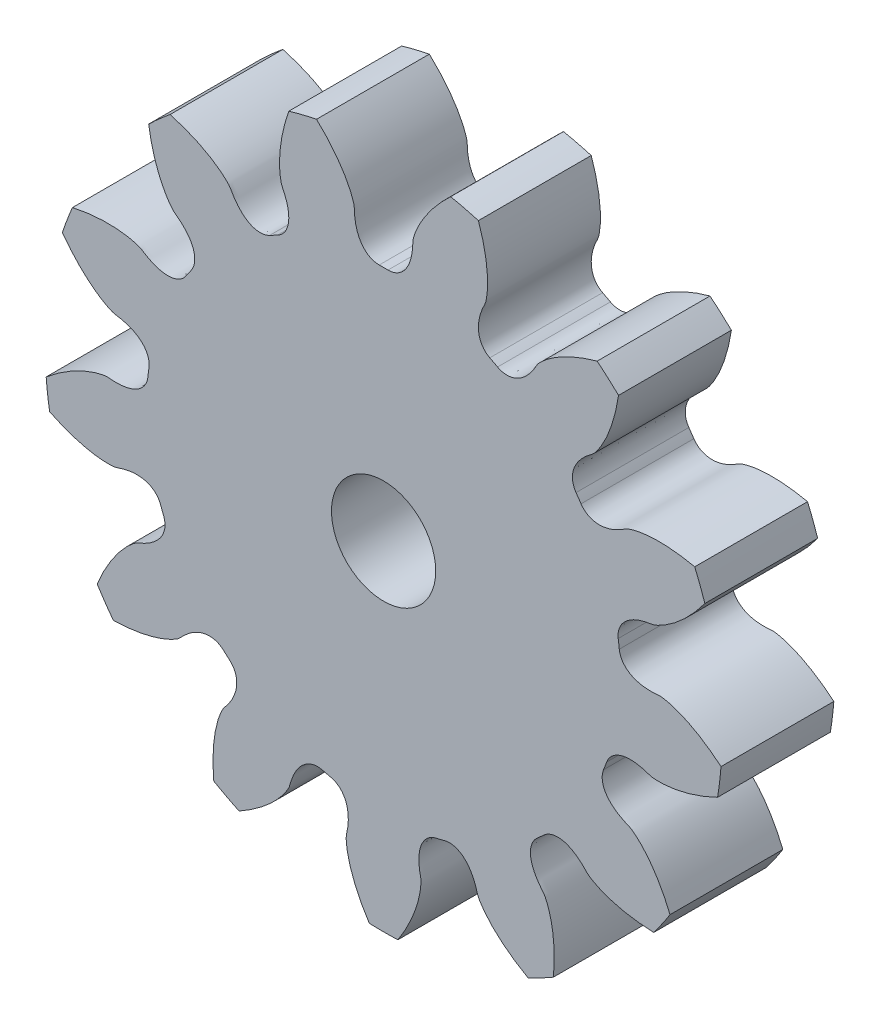
from build123d import *

# Parameters (mm, degrees)
GEAR_BASESKETCH_R                         = 19.05
NON_STANDARD_PITCHES_1_3000IN_P_D_DEPTH   = 3.175
TOOTH_CUT_D_P_10_0000_P_A_20_000DEG_DEPTH = 28.127211891
TOOTH_PATTERN_13_13_COUNT                 = 13
SKETCH1_R                                 = 2.9337
EXTRUDE1_DEPTH                            = 28.638554414


with BuildPart() as part:
    # Gear-BaseSketch → Non-standard pitches, 1.3000in P.D. (new, symmetric)
    with BuildSketch(Plane.XY):
        Circle(GEAR_BASESKETCH_R)
    extrude(amount=NON_STANDARD_PITCHES_1_3000IN_P_D_DEPTH, both=True)

    # Tooth-Sketch; Backlash: 0.0000in → Tooth-Cut, D.P.=10.0000, P.A.=20.000deg (cut, symmetric)
    with BuildSketch(Plane.XY):
        with BuildLine():
            ThreePointArc((-3.848123907, 18.742248793), (0, 19.133215815), (3.848123907, 18.742248793))
            add(Edge.make_bspline(
                [(3.848123907, 18.742248793), (3.721847674, 18.623079175), (3.478003914, 18.392958533), (3.145946183, 18.039256735), (2.853552974, 17.698392842), (2.60015953, 17.372000241), (2.383316311, 17.063284873), (2.200760912, 16.774866814), (2.049994663, 16.509274747), (1.928305441, 16.268827859), (1.833061471, 16.055619472), (1.760812379, 15.871606261), (1.709960419, 15.718300982), (1.629908483, 15.453519698), (1.644942968, 15.183129873), (1.613330997, 14.919877148), (1.594646659, 14.794792361), (1.563877215, 14.634950801), (1.514730254, 14.443536257), (1.43631308, 14.225464778), (1.336905979, 14.02087434), (1.212430405, 13.82972044), (1.056655347, 13.653956136), (0.861951582, 13.500358692), (0.623799994, 13.383320565), (0.40967144, 13.338204701), (0.281415938, 13.333876909), (0.24693607, 13.332713436)],
                knots=[0, 0, 0, 0, 0.076117063, 0.146984674, 0.212602832, 0.272971539, 0.328090793, 0.377960595, 0.422580946, 0.461951845, 0.496073292, 0.524945288, 0.548567833, 0.566940929, 0.645853261, 0.664795267, 0.683261933, 0.701285877, 0.73615521, 0.769795997, 0.802733439, 0.835672692, 0.869514682, 0.905270767, 0.94373674, 0.984874335, 1, 1, 1, 1], degree=3))
            ThreePointArc((0.24693607, 13.332713436), (0, 13.335), (-0.24693607, 13.332713436))
            add(Edge.make_bspline(
                [(-3.848123907, 18.742248793), (-3.721847674, 18.623079175), (-3.478003914, 18.392958533), (-3.145946183, 18.039256735), (-2.853552974, 17.698392842), (-2.60015953, 17.372000241), (-2.383316311, 17.063284873), (-2.200760912, 16.774866814), (-2.049994663, 16.509274747), (-1.928305441, 16.268827859), (-1.833061471, 16.055619472), (-1.760812379, 15.871606261), (-1.709960419, 15.718300982), (-1.629908483, 15.453519698), (-1.644942968, 15.183129873), (-1.613330997, 14.919877148), (-1.594646659, 14.794792361), (-1.563877215, 14.634950801), (-1.514730254, 14.443536257), (-1.43631308, 14.225464778), (-1.336905979, 14.02087434), (-1.212430405, 13.82972044), (-1.056655347, 13.653956136), (-0.861951582, 13.500358692), (-0.623799994, 13.383320565), (-0.40967144, 13.338204701), (-0.281415938, 13.333876909), (-0.24693607, 13.332713436)],
                knots=[0, 0, 0, 0, 0.076117063, 0.146984674, 0.212602832, 0.272971539, 0.328090793, 0.377960595, 0.422580946, 0.461951845, 0.496073292, 0.524945288, 0.548567833, 0.566940929, 0.645853261, 0.664795267, 0.683261933, 0.701285877, 0.73615521, 0.769795997, 0.802733439, 0.835672692, 0.869514682, 0.905270767, 0.94373674, 0.984874335, 1, 1, 1, 1], degree=3))
        make_face()
    tooth_cut_d_p_10_0000_p_a_20_000deg = extrude(amount=TOOTH_CUT_D_P_10_0000_P_A_20_000DEG_DEPTH, both=True, mode=Mode.SUBTRACT)

    # Tooth Pattern, 13 / 13: Tooth-Cut, D.P.=10.0000, P.A.=20.000deg ×13 about axis
    tooth_pattern_13_13_axis = Axis((0, 0, -88.99), (0, 0, 1))
    for i in range(1, TOOTH_PATTERN_13_13_COUNT):
        add(tooth_cut_d_p_10_0000_p_a_20_000deg.rotate(tooth_pattern_13_13_axis, i * 360 / TOOTH_PATTERN_13_13_COUNT), mode=Mode.SUBTRACT)

    # Sketch1 → Extrude1 (cut, through all)
    with BuildSketch(Plane.XY.offset(3.175)):
        Circle(SKETCH1_R)
    extrude(amount=-EXTRUDE1_DEPTH, mode=Mode.SUBTRACT)


solid = part.part
